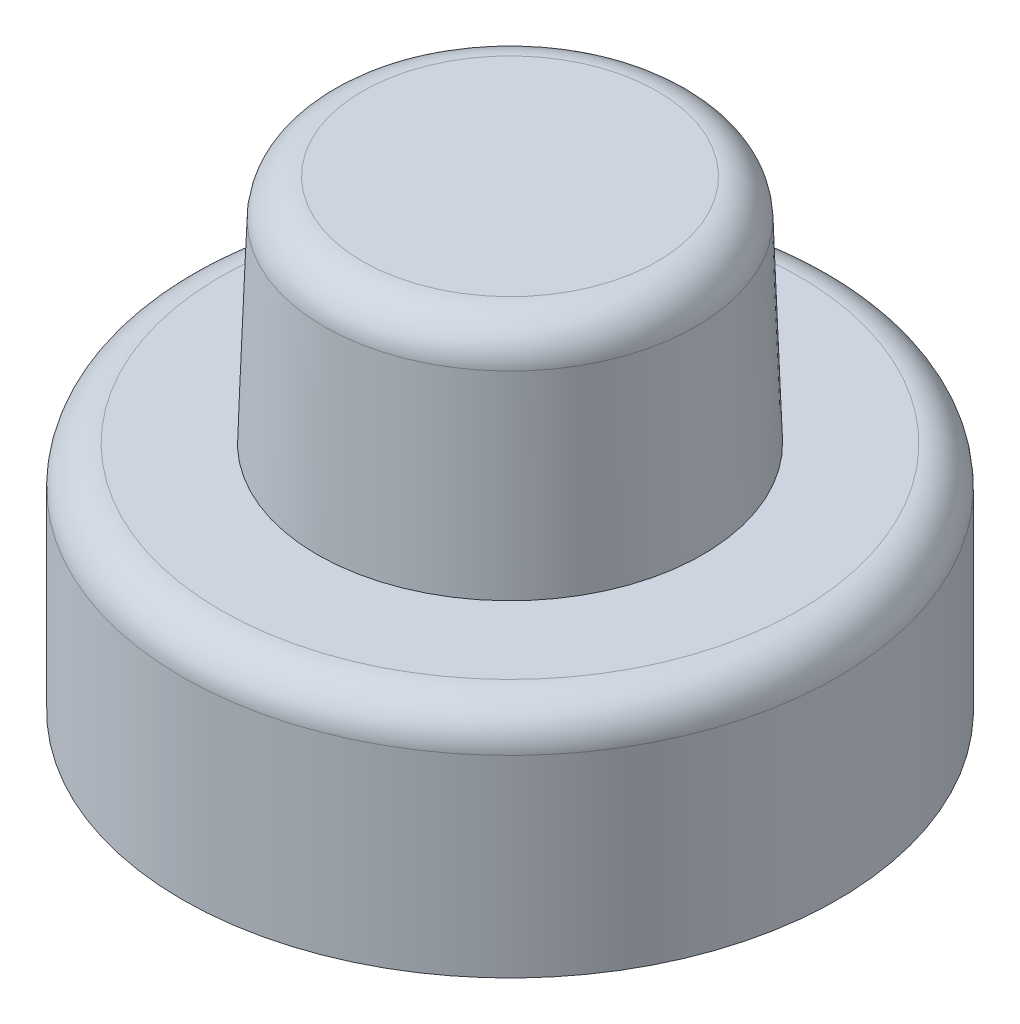
from build123d import *

# Parameters (mm, degrees)
SKETCH1_R           = 8.5
BOSS_EXTRUDE1_DEPTH = 6
FILLET2_R           = 1
SKETCH2_R           = 5
BOSS_EXTRUDE3_DEPTH = 6
BOSS_EXTRUDE3_TAPER = 2
FILLET4_R           = 1


with BuildPart() as part:
    # Sketch1 → Boss-Extrude1 (new body)
    with BuildSketch(Plane(origin=(0, 0, 0), x_dir=(1, 0, 0), z_dir=(0, 1, 0))):
        with Locations(Location((-51.120170416, 0, 0), (0, 0, 270))):
            Circle(SKETCH1_R)
    extrude(amount=BOSS_EXTRUDE1_DEPTH)

    # Fillet2
    fillet2_edges = [part.edges().sort_by_distance(p)[0] for p in [
        (-51.120170416, 6, -8.5),
    ]]
    fillet(fillet2_edges, radius=FILLET2_R)

    # Sketch2 → Boss-Extrude3 (add)
    with BuildSketch(Plane(origin=(0, 6, 0), x_dir=(1, 0, 0), z_dir=(0, 1, 0))):
        with Locations((-51.120170416, 0)):
            Circle(SKETCH2_R)
    extrude(amount=BOSS_EXTRUDE3_DEPTH, taper=BOSS_EXTRUDE3_TAPER)

    # Fillet4
    fillet4_edges = [part.edges().sort_by_distance(p)[0] for p in [
        (-55.9106458, 12, 0),
    ]]
    fillet(fillet4_edges, radius=FILLET4_R)


solid = part.part
